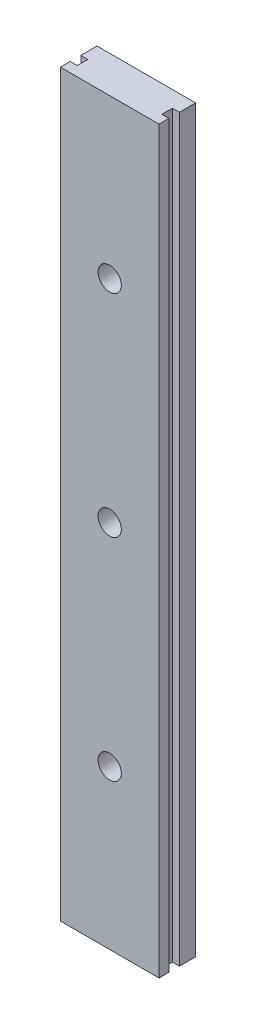
from build123d import *

# Parameters (mm, degrees)
EXTRUDE_1_DEPTH     = 105
SKETCH_2_R          = 1.65
CUT_EXTRUDE_1_DEPTH = 107.056777247


with BuildPart() as part:
    # 草图1 → 凸台-拉伸1 (new body)
    with BuildSketch(Plane(origin=(0, 0, 0), x_dir=(1, 0, 0), z_dir=(0, 1, 0))):
        Polygon((0, 0), (0, 1.4), (1, 1.4), (1, 2.9), (0, 2.9), (0, 5.2), (14, 5.2), (14, 2.9), (13, 2.9), (13, 1.4), (14, 1.4), (14, 0), align=None)
    extrude(amount=EXTRUDE_1_DEPTH)

    # 草图2 → 切除-拉伸1 (cut, through all)
    with BuildSketch(Plane(origin=(0, 0, -5.2), x_dir=(-1, 0, 0), z_dir=(0, 0, -1))):
        with Locations((-7, 52.5)):
            Circle(SKETCH_2_R)
        with Locations((-7, 82.5)):
            Circle(SKETCH_2_R)
        with Locations((-7, 22.5)):
            Circle(SKETCH_2_R)
    extrude(amount=-CUT_EXTRUDE_1_DEPTH, mode=Mode.SUBTRACT)


solid = part.part
